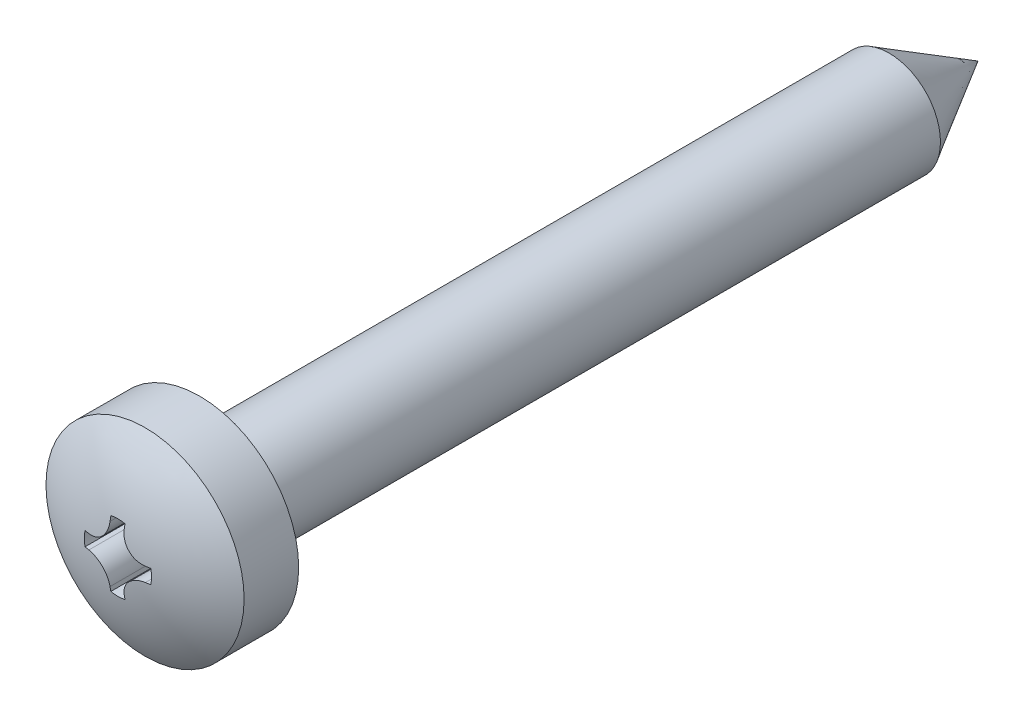
from build123d import *

# Parameters (mm, degrees)
CUT_EXTRUDE_2_DEPTH = 1.2
FILLET_1_R          = 0.1


with BuildPart() as part:
    # 草图8 → Revolve 1542 (revolve)
    with BuildSketch(Plane(origin=(0, 0, 0), x_dir=(0, 0, -1), z_dir=(1, 0, 0)), mode=Mode.PRIVATE) as revolve_1542_sk:
        with BuildLine():
            Line((0, 0), (-24.4, 0))
            ThreePointArc((-24.4, 0), (-24.180811394, 1.464186604), (-23.542463035, 2.8))
            Line((-23.542463035, 2.8), (-22, 2.8))
            Line((-22, 2.8), (-22, 1.45))
            Line((-22, 1.45), (-2.511473671, 1.45))
            Line((-2.511473671, 1.45), (0, 0))
        make_face()
    revolve(revolve_1542_sk.sketch.rotate(Axis((0, 0, 11.71), (0, 0, -1)), 90), axis=Axis((0, 0, 11.71), (0, 0, -1)))

    # 草图7 → 切除-拉伸2 (cut)
    with BuildSketch(Plane.XY.offset(24.4)):
        with BuildLine():
            Line((0.2, 0.928708781), (0.2, 0.797500009))
            ThreePointArc((0.2, 0.797500009), (0.375003701, 0.375003701), (0.797500009, 0.2))
            Line((0.797500009, 0.2), (0.928708781, 0.2))
            ThreePointArc((0.928708781, 0.2), (0.95, 0), (0.928708781, -0.2))
            Line((0.928708781, -0.2), (0.797500009, -0.2))
            ThreePointArc((0.797500009, -0.2), (0.375003701, -0.375003701), (0.2, -0.797500009))
            Line((0.2, -0.797500009), (0.2, -0.928708781))
            ThreePointArc((0.2, -0.928708781), (0, -0.95), (-0.2, -0.928708781))
            Line((-0.2, -0.928708781), (-0.2, -0.797500009))
            ThreePointArc((-0.2, -0.797500009), (-0.375003701, -0.375003701), (-0.797500009, -0.2))
            Line((-0.797500009, -0.2), (-0.928708781, -0.2))
            ThreePointArc((-0.928708781, -0.2), (-0.95, 0), (-0.928708781, 0.2))
            Line((-0.928708781, 0.2), (-0.797500009, 0.2))
            ThreePointArc((-0.797500009, 0.2), (-0.375003701, 0.375003701), (-0.2, 0.797500009))
            Line((-0.2, 0.797500009), (-0.2, 0.928708781))
            ThreePointArc((-0.2, 0.928708781), (0, 0.95), (0.2, 0.928708781))
        make_face()
    extrude(amount=-CUT_EXTRUDE_2_DEPTH, mode=Mode.SUBTRACT)

    # 圆角1
    fillet_1_edges = [part.edges().sort_by_distance(p)[0] for p in [
        (-1.45, 0, 22),
    ]]
    fillet(fillet_1_edges, radius=FILLET_1_R)


solid = part.part
